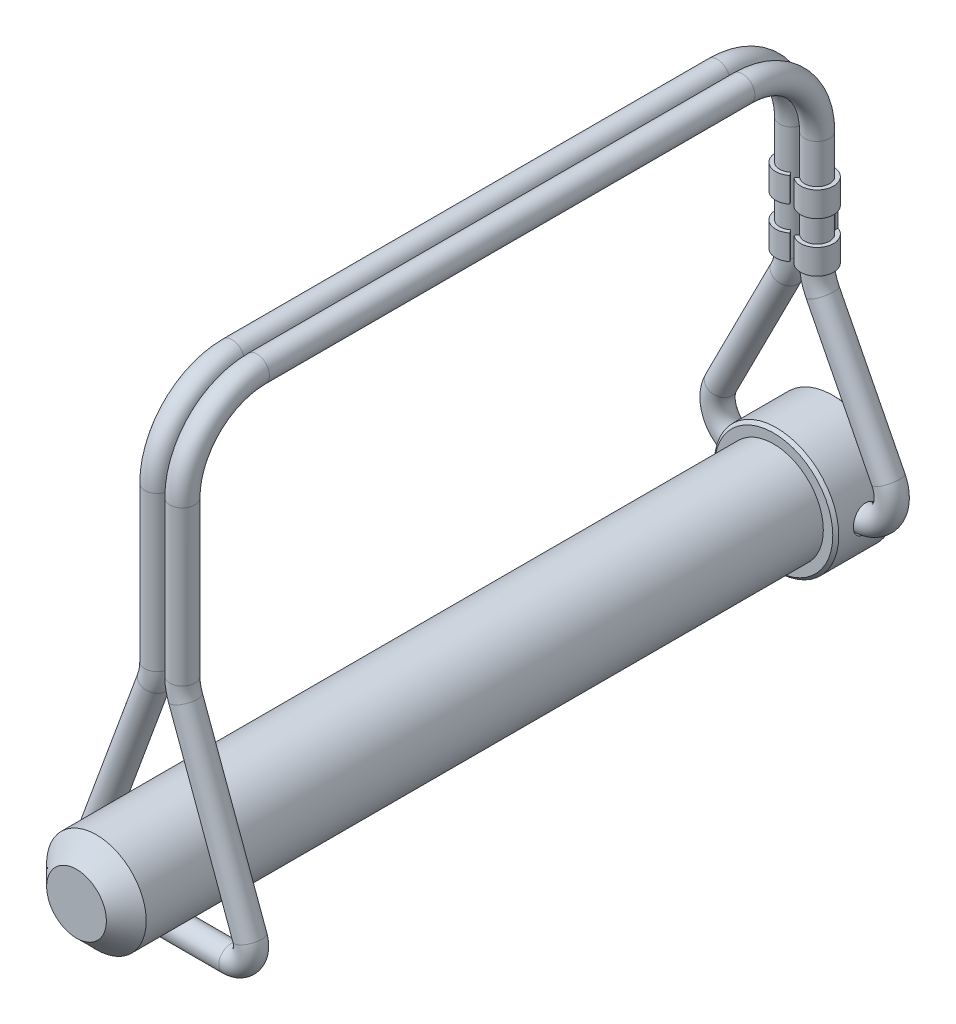
from build123d import *

# Parameters (mm, degrees)
CUT_EXTRUDE1_DEPTH      = 50.702949249
CUT_EXTRUDE1_DEPTH_BACK = 50.702949249
SKETCH2_R               = 1.7145
SKETCH7_R               = 1.5875
BOSS_EXTRUDE1_DEPTH     = 9.525
CUT_EXTRUDE4_DEPTH      = 72.318338205
CUT_EXTRUDE4_DEPTH_BACK = 72.318338205
SKETCH9_W               = 46.0375
SKETCH9_H               = 3.175
SKETCH10_W              = 0.68391593
SKETCH10_H              = 3.175
CUT_EXTRUDE5_DEPTH      = 109.444173614


with BuildPart() as part:
    # Sketch1 → Revolve1 (revolve)
    with BuildSketch(Plane(origin=(0, 0, 0), x_dir=(0, 0, -1), z_dir=(1, 0, 0)), mode=Mode.PRIVATE) as revolve1_sk:
        Polygon((-48.41875, 0), (48.41875, 0), (48.41875, 7.5565), (48.03775, 7.9375), (40.86225, 7.9375), (40.48125, 7.5565), (40.48125, 6.35), (-45.87875, 6.35), (-48.41875, 3.81), align=None)
    revolve(revolve1_sk.sketch.rotate(Axis((0, 0, 48.41875), (0, 0, -1)), 90), axis=Axis((0, 0, 48.41875), (0, 0, -1)))

    # Sketch2 → Cut-Extrude1 (cut, two sides: drawn at the far end of the back side and taken through both)
    with BuildSketch(Plane(origin=(0, 0, 0), x_dir=(0, 0, -1), z_dir=(1, 0, 0)).offset(-CUT_EXTRUDE1_DEPTH_BACK)):
        with Locations((44.45, 0)):
            Circle(SKETCH2_R)
    extrude(amount=CUT_EXTRUDE1_DEPTH + CUT_EXTRUDE1_DEPTH_BACK, mode=Mode.SUBTRACT)


with BuildPart() as body_2:
    # Sweep1: sweep along a curve in space
    with BuildLine() as sweep1_path:
        Line((-1.59385, 39.6875, 36.5125), (-1.59385, 20.6375, 36.5125))
        Line((-1.59385, 20.6375, 36.5125), (-1.59385, 20.0025, 36.5125))
        ThreePointArc((-1.59385, 20.0025, 36.5125), (-1.691870598, 18.891080388, 36.5125), (-1.982906238, 17.813973221, 36.5125))
        Line((-1.982906238, 17.813973221, 36.5125), (-10.206778889, -4.585589288, 36.5125))
        ThreePointArc((-10.206778889, -4.585589288, 36.5125), (-9.905085135, -6.914969875, 36.5125), (-7.822401384, -8.001, 36.5125))
        Line((-7.822401384, -8.001, 36.5125), (7.822401384, -8.001, 36.5125))
        ThreePointArc((7.822401384, -8.001, 36.5125), (9.905085135, -6.914969875, 36.5125), (10.206778889, -4.585589288, 36.5125))
        Line((10.206778889, -4.585589288, 36.5125), (1.982906238, 17.813973221, 36.5125))
        ThreePointArc((1.982906238, 17.813973221, 36.5125), (1.691870598, 18.891080388, 36.5125), (1.59385, 20.0025, 36.5125))
        Line((1.59385, 20.0025, 36.5125), (1.59385, 20.6375, 36.5125))
        Line((1.59385, 20.6375, 36.5125), (1.59385, 39.6875, 36.5125))
        ThreePointArc((1.59385, 39.6875, 36.5125), (1.59385, 46.422692091, 33.722692091), (1.59385, 49.2125, 26.9875))
        Line((1.59385, 49.2125, 26.9875), (1.59385, 49.2125, -34.925))
        ThreePointArc((1.59385, 49.2125, -34.925), (1.59385, 46.422692091, -41.660192091), (1.59385, 39.6875, -44.45))
        Line((1.59385, 39.6875, -44.45), (1.59385, 25.796875, -44.45))
        Line((1.59385, 25.796875, -44.45), (1.59385, 25.161875, -44.45))
        ThreePointArc((1.59385, 25.161875, -44.45), (1.768676503, 23.682100597, -44.45), (2.28352946, 22.283807701, -44.45))
        Line((2.28352946, 22.283807701, -44.45), (10.681450338, 5.767542062, -44.45))
        ThreePointArc((10.681450338, 5.767542062, -44.45), (10.526790981, 1.893657163, -44.45), (7.14375, 0, -44.45))
        Line((7.14375, 0, -44.45), (-7.14375, 0, -44.45))
        ThreePointArc((-7.14375, 0, -44.45), (-10.526790981, 1.893657163, -44.45), (-10.681450338, 5.767542062, -44.45))
        Line((-10.681450338, 5.767542062, -44.45), (-2.28352946, 22.283807701, -44.45))
        ThreePointArc((-2.28352946, 22.283807701, -44.45), (-1.768676503, 23.682100597, -44.45), (-1.59385, 25.161875, -44.45))
        Line((-1.59385, 25.161875, -44.45), (-1.59385, 25.796875, -44.45))
        Line((-1.59385, 25.796875, -44.45), (-1.59385, 39.6875, -44.45))
        ThreePointArc((-1.59385, 39.6875, -44.45), (-1.59385, 46.422692091, -41.660192091), (-1.59385, 49.2125, -34.925))
        Line((-1.59385, 49.2125, -34.925), (-1.59385, 49.2125, 26.9875))
        ThreePointArc((-1.59385, 49.2125, 26.9875), (-1.59385, 46.422692091, 33.722692091), (-1.59385, 39.6875, 36.5125))
    # Sketch7 → Sweep1 (sweep)
    with BuildSketch(Plane(origin=(0, 0, 0), x_dir=(0, 0, -1), z_dir=(1, 0, 0))):
        with Locations((44.45, 0)):
            Circle(SKETCH7_R)
    sweep(path=sweep1_path.line)


with BuildPart() as body_3:
    # Sketch8 → Boss-Extrude1 (new body)
    with BuildSketch(Plane(origin=(0, 25.161875, 0), x_dir=(1, 0, 0), z_dir=(0, 1, 0))):
        with BuildLine():
            Line((1.59385, 46.0375), (-1.59385, 46.0375))
            ThreePointArc((-1.59385, 46.0375), (-3.086808848, 43.910342583), (-0.578812121, 43.229404099))
            Line((-0.578812121, 43.229404099), (-0.254, 42.83881341))
            ThreePointArc((-0.254, 42.83881341), (-3.564555679, 43.737652209), (-1.59385, 46.5455))
            Line((-1.59385, 46.5455), (1.59385, 46.5455))
            ThreePointArc((1.59385, 46.5455), (3.564555679, 43.737652209), (0.254, 42.83881341))
            Line((0.254, 42.83881341), (0.578812121, 43.229404099))
            ThreePointArc((0.578812121, 43.229404099), (3.086808848, 43.910342583), (1.59385, 46.0375))
        make_face()
    extrude(amount=BOSS_EXTRUDE1_DEPTH)

    # Sketch9 → Cut-Extrude4 (cut, two sides: drawn at the far end of the back side and taken through both)
    with BuildSketch(Plane(origin=(0, 0, 0), x_dir=(0, 0, -1), z_dir=(1, 0, 0)).offset(-CUT_EXTRUDE4_DEPTH_BACK)):
        with Locations((23.01875, 29.924375)):
            Rectangle(SKETCH9_W, SKETCH9_H)
    extrude(amount=CUT_EXTRUDE4_DEPTH + CUT_EXTRUDE4_DEPTH_BACK, mode=Mode.SUBTRACT)

    # Sketch10 → Cut-Extrude5 (cut, through all)
    with BuildSketch(Plane(origin=(0, 0, -46.5455), x_dir=(-1, 0, 0), z_dir=(0, 0, -1))):
        with Locations((-2.619723896, 29.924375)):
            Rectangle(SKETCH10_W, SKETCH10_H)
        with Locations((2.619723896, 29.924375)):
            Rectangle(SKETCH10_W, SKETCH10_H)
    extrude(amount=-CUT_EXTRUDE5_DEPTH, mode=Mode.SUBTRACT)


solid = Compound([part.part, body_2.part, body_3.part])
